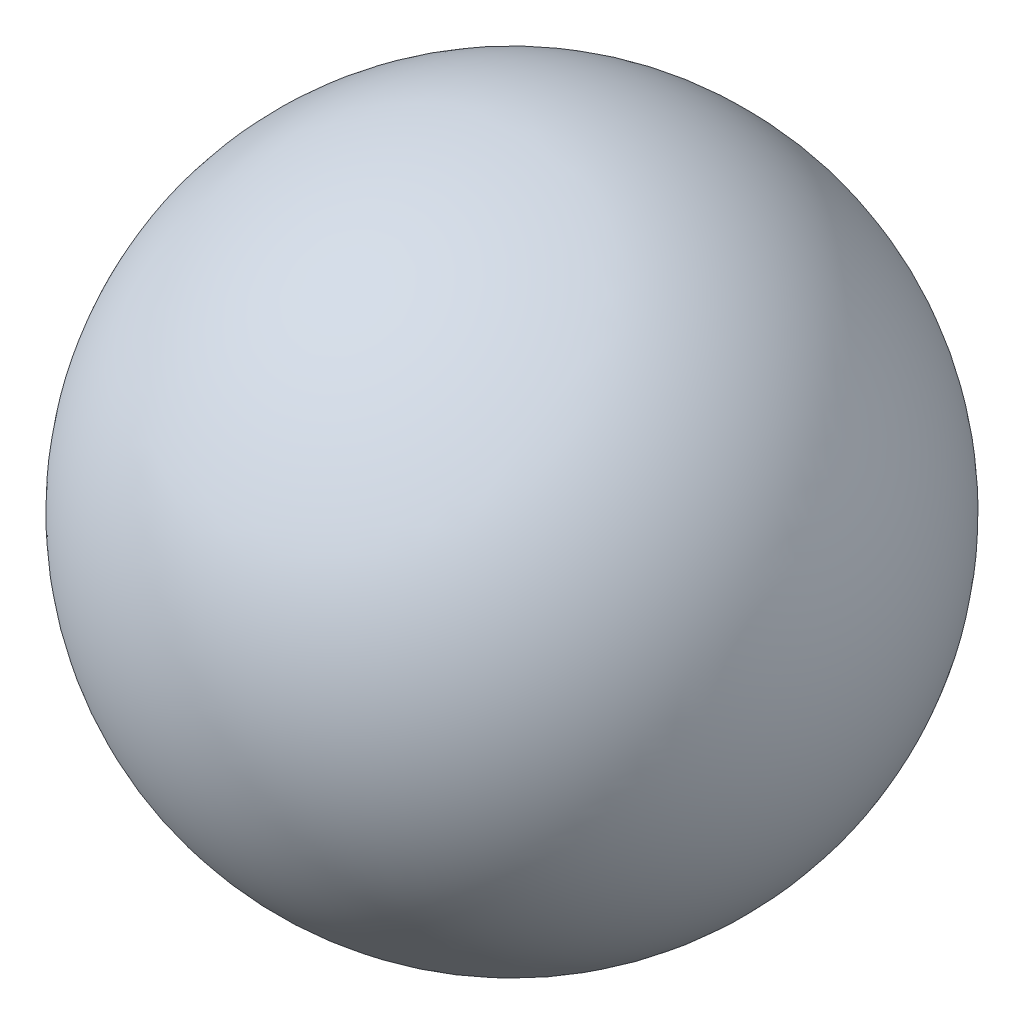
from build123d import *


with BuildPart() as part:
    # Esquisse1 → Révolution1 (revolve)
    with BuildSketch(Plane.XY):
        with BuildLine():
            Line((0, 0), (25.4, 0))
            ThreePointArc((25.4, 0), (12.7, 12.7), (0, 0))
        make_face()
    revolve(axis=Axis((0, 0, 0), (1, 0, 0)))


solid = part.part
